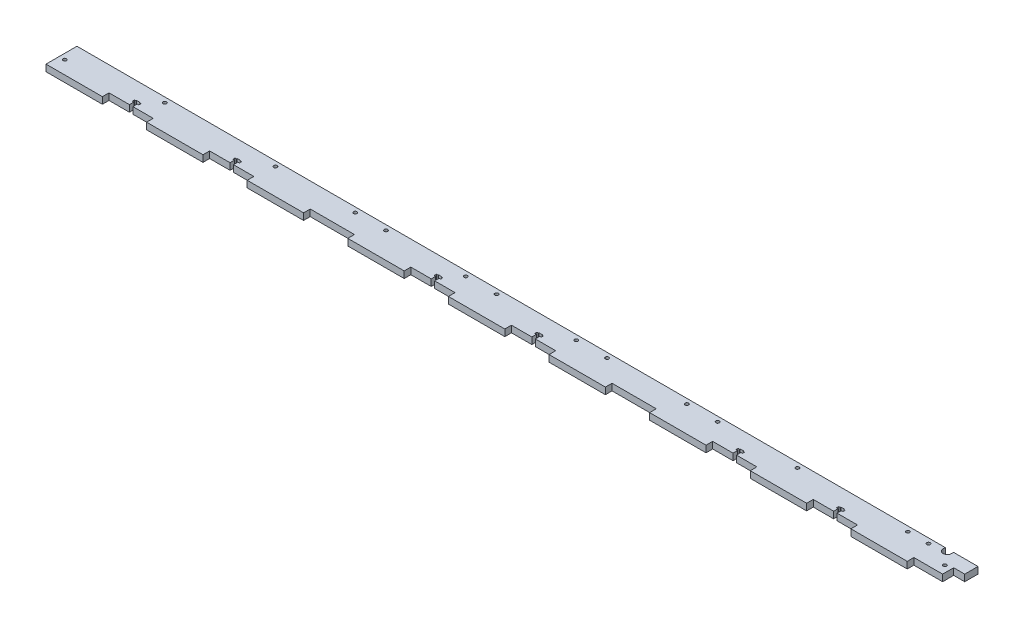
from build123d import *

# Parameters (mm, degrees)
DODANIE_WYCI_GNI_CIE2_DEPTH      = 3
DODANIE_WYCI_GNI_CIE2_DEPTH_BACK = 3
SZKIC1_W                         = 880
SZKIC1_H                         = 69
SZKIC1_W_2                       = 735
SZKIC1_H_2                       = 28
SZKIC2_W                         = 40
SZKIC2_H                         = 6
WYTNIJ_WYCI_GNI_CIE1_DEPTH       = 6
SZYK_LINIOWY1_COUNT              = 13
SZYK_LINIOWY1_PITCH              = 91
WYTNIJ_WYCI_GNI_CIE2_DEPTH       = 6
SZKIC9_R                         = 12.5
WYTNIJ_WYCI_GNI_CIE6_DEPTH       = 6
WYTNIJ_WYCI_GNI_CIE7_DEPTH       = 6
SZKIC13_W                        = 25
SZKIC13_H                        = 15
WYTNIJ_WYCI_GNI_CIE8_DEPTH       = 6
SZYK_LINIOWY3_COUNT              = 2
SZYK_LINIOWY3_PITCH              = 91
SZYK_LINIOWY3_COUNT_DIR2         = 3
SZYK_LINIOWY3_PITCH_DIR2         = 273
SZKIC14_OUTSIDE_W                = 1058.544
SZKIC14_OUTSIDE_H                = 247.544
SZKIC14_OUTSIDE_W_2              = 815
SZKIC14_OUTSIDE_H_2              = 28
WYTNIJ_WYCI_GNI_CIE9_DEPTH       = 10
SZKIC15_R                        = 1.55
WYTNIJ_WYCI_GNI_CIE10_DEPTH      = 10
SZKIC18_R                        = 1.55
WYTNIJ_WYCI_GNI_CIE11_DEPTH      = 10
SZKIC19_R                        = 1.55
WYTNIJ_WYCI_GNI_CIE12_DEPTH      = 10
SZYK_LINIOWY4_COUNT              = 6
SZYK_LINIOWY4_PITCH              = 100
SZKIC20_W                        = 10
SZKIC20_H                        = 10
WYTNIJ_WYCI_GNI_CIE13_DEPTH      = 10


with BuildPart() as part:
    # Szkic1 → Dodanie-wyciągnięcie2 (new, two sides: drawn at the far end of the back side and taken through both)
    with BuildSketch(Plane(origin=(0, -418.87633849, -418.87633849), x_dir=(1, 0, 0), z_dir=(0, 1, 0)).offset(-DODANIE_WYCI_GNI_CIE2_DEPTH_BACK)):
        with Locations((-705.368459045, -443.37633849)):
            Rectangle(SZKIC1_W, SZKIC1_H)
        with Locations((-703.368459045, -435.87633849)):
            Rectangle(SZKIC1_W_2, SZKIC1_H_2, mode=Mode.SUBTRACT)
    extrude(amount=DODANIE_WYCI_GNI_CIE2_DEPTH + DODANIE_WYCI_GNI_CIE2_DEPTH_BACK)

    # Szkic2 → Wytnij-wyciągnięcie1 (cut)
    with BuildSketch(Plane.XY.offset(59)):
        with Locations((-1125.368459045, -418.87633849)):
            Rectangle(SZKIC2_W, SZKIC2_H)
    wytnij_wyci_gni_cie1 = extrude(amount=-WYTNIJ_WYCI_GNI_CIE1_DEPTH, mode=Mode.SUBTRACT)

    # Szyk liniowy1: Wytnij-wyciągnięcie1 ×13
    with Locations(*[(i * SZYK_LINIOWY1_PITCH, 0, 0) for i in range(1, SZYK_LINIOWY1_COUNT)]):
        add(wytnij_wyci_gni_cie1, mode=Mode.SUBTRACT)

    # Szkic3 → Wytnij-wyciągnięcie2 (cut)
    with BuildSketch(Plane(origin=(0, -415.87633849, 0), x_dir=(1, 0, 0), z_dir=(0, 1, 0))):
        Polygon((-1032.818459045, -53), (-1035.918459045, -53), (-1035.918459045, -49), (-1037.293459045, -49), (-1037.293459045, -47), (-1035.918459045, -47), (-1035.918459045, -46.5), (-1032.818459045, -46.5), (-1032.818459045, -47), (-1031.443459045, -47), (-1031.443459045, -49), (-1032.818459045, -49), align=None)
    wytnij_wyci_gni_cie2 = extrude(amount=-WYTNIJ_WYCI_GNI_CIE2_DEPTH, mode=Mode.SUBTRACT)

    # Szkic9 → Wytnij-wyciągnięcie6 (cut)
    with BuildSketch(Plane(origin=(0, -415.87633849, 0), x_dir=(1, 0, 0), z_dir=(0, 1, 0))):
        with Locations((-300.706340265, -17.43)):
            Circle(SZKIC9_R)
    extrude(amount=-WYTNIJ_WYCI_GNI_CIE6_DEPTH, mode=Mode.SUBTRACT)

    # Szkic11 → Wytnij-wyciągnięcie7 (cut)
    with BuildSketch(Plane.XZ.offset(421.87633849)):
        with BuildLine():
            Line((-319.956340265, 32.93), (-319.956340265, 30.976099153))
            Line((-319.956340265, 30.976099153), (-312.456340265, 30.976099153))
            Line((-312.456340265, 30.976099153), (-312.456340265, 32.93))
            ThreePointArc((-312.456340265, 32.93), (-316.206340265, 36.68), (-319.956340265, 32.93))
        make_face()
    extrude(amount=-WYTNIJ_WYCI_GNI_CIE7_DEPTH, mode=Mode.SUBTRACT)

    # Szkic13 → Wytnij-wyciągnięcie8 (cut)
    with BuildSketch(Plane(origin=(0, -415.87633849, 0), x_dir=(1, 0, 0), z_dir=(0, 1, 0))):
        with Locations((-277.868459045, -51.5)):
            Rectangle(SZKIC13_W, SZKIC13_H)
    extrude(amount=-WYTNIJ_WYCI_GNI_CIE8_DEPTH, mode=Mode.SUBTRACT)

    # Szyk liniowy3: Wytnij-wyci_gni_cie2 2 × 3
    with Locations(*[Vector(1, 0, 0) * (i * SZYK_LINIOWY3_PITCH) + Vector(1, 0, 0) * (j * SZYK_LINIOWY3_PITCH_DIR2) for i in range(SZYK_LINIOWY3_COUNT) for j in range(SZYK_LINIOWY3_COUNT_DIR2) if (i, j) != (0, 0)]):
        add(wytnij_wyci_gni_cie2, mode=Mode.SUBTRACT)

    # Szkic14 outside → Wytnij-wyciągnięcie9 (cut)
    with BuildSketch(Plane(origin=(0, -415.87633849, 0), x_dir=(1, 0, 0), z_dir=(0, 1, 0))):
        with Locations((-705.368, -24.5)):
            Rectangle(SZKIC14_OUTSIDE_W, SZKIC14_OUTSIDE_H)
        with Locations((-697.868459045, -45)):
            Rectangle(SZKIC14_OUTSIDE_W_2, SZKIC14_OUTSIDE_H_2, mode=Mode.SUBTRACT)
    extrude(amount=-WYTNIJ_WYCI_GNI_CIE9_DEPTH, mode=Mode.SUBTRACT)

    # Szkic15 → Wytnij-wyciągnięcie10 (cut)
    with BuildSketch(Plane(origin=(0, -415.87633849, 0), x_dir=(1, 0, 0), z_dir=(0, 1, 0))):
        with Locations((-1100.368459045, -47)):
            Circle(SZKIC15_R)
        with Locations((-306.36620557, -45)):
            Circle(SZKIC15_R)
    extrude(amount=-WYTNIJ_WYCI_GNI_CIE10_DEPTH, mode=Mode.SUBTRACT)

    # Szkic18 → Wytnij-wyciągnięcie11 (cut)
    with BuildSketch(Plane(origin=(0, -415.87633849, 0), x_dir=(1, 0, 0), z_dir=(0, 1, 0))):
        with Locations((-330.638459045, -35.5)):
            Circle(SZKIC18_R)
    extrude(amount=-WYTNIJ_WYCI_GNI_CIE11_DEPTH, mode=Mode.SUBTRACT)

    # Szkic19 → Wytnij-wyciągnięcie12 (cut)
    with BuildSketch(Plane(origin=(0, -415.87633849, 0), x_dir=(1, 0, 0), z_dir=(0, 1, 0))):
        with Locations((-1021.368458991, -35.5)):
            Circle(SZKIC19_R)
        with Locations((-849.218458991, -35.5)):
            Circle(SZKIC19_R)
    wytnij_wyci_gni_cie12 = extrude(amount=-WYTNIJ_WYCI_GNI_CIE12_DEPTH, mode=Mode.SUBTRACT)

    # Szyk liniowy4: Wytnij-wyciągnięcie12 ×6
    with Locations(*[(i * SZYK_LINIOWY4_PITCH, 0, 0) for i in range(1, SZYK_LINIOWY4_COUNT)]):
        add(wytnij_wyci_gni_cie12, mode=Mode.SUBTRACT)

    # Szkic20 → Wytnij-wyciągnięcie13 (cut)
    with BuildSketch(Plane(origin=(0, -415.87633849, 0), x_dir=(1, 0, 0), z_dir=(0, 1, 0))):
        with Locations((-295.368459045, -48)):
            Rectangle(SZKIC20_W, SZKIC20_H)
    extrude(amount=-WYTNIJ_WYCI_GNI_CIE13_DEPTH, mode=Mode.SUBTRACT)


solid = part.part
